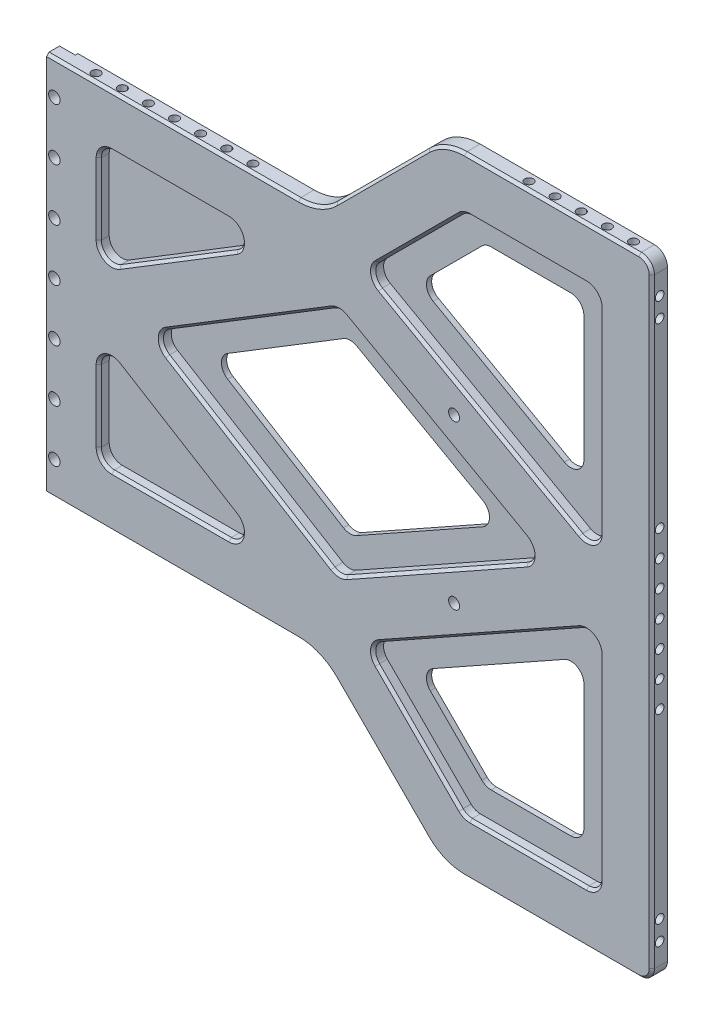
from build123d import *

# Parameters (mm, degrees)
EXTRUDE_1_DEPTH             = 1
EXTRUDE_2_DEPTH             = 5
FILLET_1_R                  = 20
CUT_EXTRUDE_1_DEPTH         = 4
FILLET_2_R                  = 5
CUT_EXTRUDE_2_DEPTH         = 5
FILLET_3_R                  = 5
FILLET_4_R                  = 5
CHAMFER_1_SIZE              = 1
CHAMFER_2_SIZE              = 1
CUT_EXTRUDE_3_DEPTH         = 266.872881163
CUT_EXTRUDE_3_DEPTH_BACK    = 266.872881163
SKETCH_5_R                  = 2.2
HOLE_WIZARD_M4_1_AT_2_COUNT = 2
HOLE_WIZARD_M4_1_AT_2_PITCH = 10
HOLE_WIZARD_M4_1_AT_3_COUNT = 2
HOLE_WIZARD_M4_1_AT_3_PITCH = 20
HOLE_WIZARD_M4_1_AT_4_COUNT = 2
HOLE_WIZARD_M4_1_AT_4_PITCH = 30
HOLE_WIZARD_M4_1_AT_5_COUNT = 2
HOLE_WIZARD_M4_1_AT_5_PITCH = 40
HOLE_WIZARD_M4_1_AT_6_COUNT = 2
HOLE_WIZARD_M4_1_AT_6_PITCH = 50
HOLE_WIZARD_M4_1_AT_7_COUNT = 2
HOLE_WIZARD_M4_1_AT_7_PITCH = 60
HOLE_WIZARD_M4_2_AT_2_COUNT = 2
HOLE_WIZARD_M4_2_AT_2_PITCH = 10
HOLE_WIZARD_M4_2_AT_3_COUNT = 2
HOLE_WIZARD_M4_2_AT_3_PITCH = 20
HOLE_WIZARD_M4_2_AT_4_COUNT = 2
HOLE_WIZARD_M4_2_AT_4_PITCH = 30
HOLE_WIZARD_M4_2_AT_5_COUNT = 2
HOLE_WIZARD_M4_2_AT_5_PITCH = 40
HOLE_WIZARD_M4_3_AT_2_COUNT = 2
HOLE_WIZARD_M4_3_AT_2_PITCH = 7.5
HOLE_WIZARD_M5_1_D          = 4.2
HOLE_WIZARD_M5_1_DEPTH      = 12.4
HOLE_WIZARD_M5_1_TIP        = 1.2618073
HOLE_WIZARD_M4_4_D          = 3.3
HOLE_WIZARD_M4_4_DEPTH      = 10.1
HOLE_WIZARD_M4_4_TIP        = 0.991420021


with BuildPart() as part:
    # 草图1 → 凸台-拉伸1 (new body)
    with BuildSketch(Plane.XY):
        Polygon((11.5, 73), (110.175860782, 73), (157.175860782, 120), (237.175860782, 120), (237.175860782, -120), (157.175860782, -120), (110.175860782, -73), (11.5, -73), align=None)
    extrude(amount=-EXTRUDE_1_DEPTH)

    # 草图2 → 凸台-拉伸2 (add)
    with BuildSketch(Plane.XY):
        Polygon((11.5, 73), (5.5, 73), (5.5, -73), (11.5, -73), (110.175860782, -73), (157.175860782, -120), (237.175860782, -120), (237.175860782, 120), (157.175860782, 120), (110.175860782, 73), align=None)
    extrude(amount=EXTRUDE_2_DEPTH)

    # 圆角1
    fillet_1_edges = [part.edges().sort_by_distance(p)[0] for p in [
        (110.175860782, 73, 2),
        (157.175860782, 120, 2),
        (157.175860782, -120, 2),
        (110.175860782, -73, 2),
    ]]
    fillet(fillet_1_edges, radius=FILLET_1_R)

    # 草图3 → 切除-拉伸1 (cut)
    with BuildSketch(Plane.XY.offset(5)):
        Polygon((196.725411073, 0), (117.41720526, -44.458394956), (44.675653042, 0), (117.41720526, 44.458394956), align=None)
        with BuildLine():
            Line((127.111323554, 61.952213992), (217.175860782, 11.464061769))
            Line((217.175860782, 11.464061769), (217.175860782, 100))
            Line((217.175860782, 100), (165.46013203, 100))
            Line((165.46013203, 100), (130.175860782, 64.715728753))
            ThreePointArc((130.175860782, 64.715728753), (128.679252709, 63.294426421), (127.111323554, 61.952213992))
        make_face()
        with BuildLine():
            Line((217.175860782, -100), (217.175860782, -11.464061769))
            Line((217.175860782, -11.464061769), (127.111323554, -61.952213992))
            ThreePointArc((127.111323554, -61.952213992), (128.679252709, -63.294426421), (130.175860782, -64.715728752))
            Line((130.175860782, -64.715728752), (165.46013203, -100))
            Line((165.46013203, -100), (217.175860782, -100))
        make_face()
        Polygon((25.5, -53), (93.041428657, -53), (25.5, -11.719831794), align=None)
        Polygon((25.5, 11.719831794), (93.041428657, 53), (25.5, 53), align=None)
    extrude(amount=-CUT_EXTRUDE_1_DEPTH, mode=Mode.SUBTRACT)

    # 圆角2
    fillet_2_edges = [part.edges().sort_by_distance(p)[0] for p in [
        (165.46013203, -100, 3),
        (217.175860782, -100, 3),
        (217.175860782, -11.464061769, 3),
        (127.111323554, -61.952213992, 3),
        (217.175860782, 11.464061769, 3),
        (165.46013203, 100, 3),
        (127.111323554, 61.952213992, 3),
        (117.41720526, 44.458394956, 3),
        (44.675653042, 0, 3),
        (117.41720526, -44.458394956, 3),
        (196.725411073, 0, 3),
        (25.5, -53, 3),
        (93.041428657, -53, 3),
        (25.5, -11.719831794, 3),
        (25.5, 53, 3),
        (25.5, 11.719831794, 3),
        (93.041428657, 53, 3),
        (217.175860782, 100, 3),
    ]]
    fillet(fillet_2_edges, radius=FILLET_2_R)

    # 草图4 → 切除-拉伸2 (cut)
    with BuildSketch(Plane.XY.offset(1)):
        Polygon((176.274961364, 0), (117.635483691, 32.871971212), (63.851306083, 0), (117.635483691, -32.871971212), align=None)
        Polygon((143.712370298, 64.110102645), (207.175860782, 28.533898438), (207.175860782, 90), (169.602267653, 90), align=None)
        Polygon((143.712370298, -64.110102644), (169.602267653, -90), (207.175860782, -90), (207.175860782, -28.533898438), align=None)
    extrude(amount=-CUT_EXTRUDE_2_DEPTH, mode=Mode.SUBTRACT)

    # 圆角3
    fillet_3_edges = [part.edges().sort_by_distance(p)[0] for p in [
        (143.712370298, -64.110102644, 0),
        (207.175860782, -28.533898438, 0),
        (207.175860782, -90, 0),
        (169.602267653, -90, 0),
        (143.712370298, 64.110102645, 0),
        (169.602267653, 90, 0),
        (207.175860782, 90, 0),
        (207.175860782, 28.533898438, 0),
        (176.274961364, 0, 0),
        (117.635483691, -32.871971212, 0),
        (63.851306083, 0, 0),
        (117.635483691, 32.871971212, 0),
    ]]
    fillet(fillet_3_edges, radius=FILLET_3_R)

    # 圆角4
    fillet_4_edges = [part.edges().sort_by_distance(p)[0] for p in [
        (237.175860782, 120, 2),
        (237.175860782, -120, 2),
    ]]
    fillet(fillet_4_edges, radius=FILLET_4_R)

    # 倒角1
    chamfer_1_edges = [part.edges().sort_by_distance(p)[0] for p in [
        (189.853530312, -100, 5),
        (147.984212406, -82.524080377, 5),
        (217.175860782, -57.499490052, 5),
        (171.397142773, -37.126580608, 5),
        (217.175860782, 57.499490052, 5),
        (171.397142773, 37.126580608, 5),
        (147.984212406, 82.524080377, 5),
        (189.853530312, 100, 5),
        (83.287438892, 23.598864376, 5),
        (154.458199356, 23.694047456, 5),
        (83.287438892, -23.598864376, 5),
        (154.458199356, -23.694047456, 5),
        (52.886372686, -53, 5),
        (25.5, -34.317831169, 5),
        (55.493845813, -30.051558335, 5),
        (25.5, 34.317831169, 5),
        (52.886372686, 53, 5),
        (55.493845813, 30.051558335, 5),
        (165.61778268, -99.619397663, 5),
        (215.711394688, -98.535533906, 5),
        (214.703243811, -15.684778552, 5),
        (130.555302658, -62.293068947, 5),
        (214.703243811, 15.684778552, 5),
        (165.61778268, 99.619397663, 5),
        (130.555302658, 62.293068948, 5),
        (117.432165413, 43.664296036, 5),
        (49.263479563, 0, 5),
        (117.432165413, -43.664296036, 5),
        (191.500186218, 0, 5),
        (26.964466094, -51.535533906, 5),
        (80.085819451, -49.354369933, 5),
        (28.054326845, -16.274620854, 5),
        (26.964466094, 51.535533906, 5),
        (28.054326845, 16.274620854, 5),
        (80.085819451, 49.354369933, 5),
        (215.711394688, 98.535533906, 5),
    ]]
    chamfer(chamfer_1_edges, length=CHAMFER_1_SIZE)

    # 倒角2
    chamfer_2_edges = [part.edges().sort_by_distance(p)[0] for p in [
        (53.695794767, -73, 5),
        (237.175860782, 0, 5),
        (198.817996406, 120, 5),
        (235.711394688, -118.535533906, 5),
        (235.711394688, 118.535533906, 5),
        (53.695794768, 73, 5),
        (133.675860782, -96.5, 5),
        (198.817996406, -120, 5),
        (133.675860782, 96.5, 5),
        (157.806463382, -118.47759065, 5),
        (157.806463382, 118.47759065, 5),
        (109.545258182, -74.52240935, 5),
        (109.545258182, 74.52240935, 5),
    ]]
    chamfer(chamfer_2_edges, length=CHAMFER_2_SIZE)

    # 草图5 → 切除-拉伸3 (cut, two sides: drawn at the far end of the back side and taken through both)
    with BuildSketch(Plane.XY.offset(5).offset(-CUT_EXTRUDE_3_DEPTH_BACK)):
        with Locations((8.5, 60)):
            Circle(SKETCH_5_R)
        with Locations((8.5, 40)):
            Circle(SKETCH_5_R)
        with Locations((8.5, 20)):
            Circle(SKETCH_5_R)
        with Locations((8.5, 0)):
            Circle(SKETCH_5_R)
        with Locations((8.5, -20)):
            Circle(SKETCH_5_R)
        with Locations((8.5, -40)):
            Circle(SKETCH_5_R)
        with Locations((8.5, -60)):
            Circle(SKETCH_5_R)
    extrude(amount=CUT_EXTRUDE_3_DEPTH + CUT_EXTRUDE_3_DEPTH_BACK, mode=Mode.SUBTRACT)

    # 草图8 → M4 螺纹孔1 (revolve, cut)
    with BuildSketch(Plane(origin=(81.5, -73, 2), x_dir=(0, 0, -1), z_dir=(1, 0, 0))):
        Polygon((0, 0), (0, 11.091420021), (1.65, 10.1), (1.65, 0), align=None)
    hole_wizard_m4_1 = revolve(axis=Axis((81.5, -79.35, 2), (0, 1, 0)), mode=Mode.SUBTRACT)

    # M4 螺纹孔1 at 2: M4 螺纹孔1 ×2
    with Locations(*[(-i * HOLE_WIZARD_M4_1_AT_2_PITCH, 0, 0) for i in range(1, HOLE_WIZARD_M4_1_AT_2_COUNT)]):
        add(hole_wizard_m4_1, mode=Mode.SUBTRACT)

    # M4 螺纹孔1 at 3: M4 螺纹孔1 ×2
    with Locations(*[(-i * HOLE_WIZARD_M4_1_AT_3_PITCH, 0, 0) for i in range(1, HOLE_WIZARD_M4_1_AT_3_COUNT)]):
        add(hole_wizard_m4_1, mode=Mode.SUBTRACT)

    # M4 螺纹孔1 at 4: M4 螺纹孔1 ×2
    with Locations(*[(-i * HOLE_WIZARD_M4_1_AT_4_PITCH, 0, 0) for i in range(1, HOLE_WIZARD_M4_1_AT_4_COUNT)]):
        add(hole_wizard_m4_1, mode=Mode.SUBTRACT)

    # M4 螺纹孔1 at 5: M4 螺纹孔1 ×2
    with Locations(*[(-i * HOLE_WIZARD_M4_1_AT_5_PITCH, 0, 0) for i in range(1, HOLE_WIZARD_M4_1_AT_5_COUNT)]):
        add(hole_wizard_m4_1, mode=Mode.SUBTRACT)

    # M4 螺纹孔1 at 6: M4 螺纹孔1 ×2
    with Locations(*[(-i * HOLE_WIZARD_M4_1_AT_6_PITCH, 0, 0) for i in range(1, HOLE_WIZARD_M4_1_AT_6_COUNT)]):
        add(hole_wizard_m4_1, mode=Mode.SUBTRACT)

    # M4 螺纹孔1 at 7: M4 螺纹孔1 ×2
    with Locations(*[(-i * HOLE_WIZARD_M4_1_AT_7_PITCH, 0, 0) for i in range(1, HOLE_WIZARD_M4_1_AT_7_COUNT)]):
        add(hole_wizard_m4_1, mode=Mode.SUBTRACT)

    # 镜向1: M4 螺纹孔1 across plane
    add(hole_wizard_m4_1.mirror(Plane.ZX), mode=Mode.SUBTRACT)

    # 镜向1 copy 1 sketch → 镜向1 copy 1 (revolve, cut)
    with BuildSketch(Plane(origin=(71.5, 73, 2), x_dir=(0, 0, -1), z_dir=(1, 0, 0))):
        Polygon((0, 0), (0, -11.091420021), (1.65, -10.1), (1.65, 0), align=None)
    revolve(axis=Axis((71.5, 79.35, 2), (0, 1, 0)), mode=Mode.SUBTRACT)

    # 镜向1 copy 2 sketch → 镜向1 copy 2 (revolve, cut)
    with BuildSketch(Plane(origin=(61.5, 73, 2), x_dir=(0, 0, -1), z_dir=(1, 0, 0))):
        Polygon((0, 0), (0, -11.091420021), (1.65, -10.1), (1.65, 0), align=None)
    revolve(axis=Axis((61.5, 79.35, 2), (0, 1, 0)), mode=Mode.SUBTRACT)

    # 镜向1 copy 3 sketch → 镜向1 copy 3 (revolve, cut)
    with BuildSketch(Plane(origin=(51.5, 73, 2), x_dir=(0, 0, -1), z_dir=(1, 0, 0))):
        Polygon((0, 0), (0, -11.091420021), (1.65, -10.1), (1.65, 0), align=None)
    revolve(axis=Axis((51.5, 79.35, 2), (0, 1, 0)), mode=Mode.SUBTRACT)

    # 镜向1 copy 4 sketch → 镜向1 copy 4 (revolve, cut)
    with BuildSketch(Plane(origin=(41.5, 73, 2), x_dir=(0, 0, -1), z_dir=(1, 0, 0))):
        Polygon((0, 0), (0, -11.091420021), (1.65, -10.1), (1.65, 0), align=None)
    revolve(axis=Axis((41.5, 79.35, 2), (0, 1, 0)), mode=Mode.SUBTRACT)

    # 镜向1 copy 5 sketch → 镜向1 copy 5 (revolve, cut)
    with BuildSketch(Plane(origin=(31.5, 73, 2), x_dir=(0, 0, -1), z_dir=(1, 0, 0))):
        Polygon((0, 0), (0, -11.091420021), (1.65, -10.1), (1.65, 0), align=None)
    revolve(axis=Axis((31.5, 79.35, 2), (0, 1, 0)), mode=Mode.SUBTRACT)

    # 镜向1 copy 6 sketch → 镜向1 copy 6 (revolve, cut)
    with BuildSketch(Plane(origin=(21.5, 73, 2), x_dir=(0, 0, -1), z_dir=(1, 0, 0))):
        Polygon((0, 0), (0, -11.091420021), (1.65, -10.1), (1.65, 0), align=None)
    revolve(axis=Axis((21.5, 79.35, 2), (0, 1, 0)), mode=Mode.SUBTRACT)

    # 草图11 → M4 螺纹孔2 (revolve, cut)
    with BuildSketch(Plane(origin=(227.175860782, -120, 2), x_dir=(0, 0, -1), z_dir=(1, 0, 0))):
        Polygon((0, 0), (0, 11.091420021), (1.65, 10.1), (1.65, 0), align=None)
    hole_wizard_m4_2 = revolve(axis=Axis((227.175860782, -126.35, 2), (0, 1, 0)), mode=Mode.SUBTRACT)

    # M4 螺纹孔2 at 2: M4 螺纹孔2 ×2
    with Locations(*[(-i * HOLE_WIZARD_M4_2_AT_2_PITCH, 0, 0) for i in range(1, HOLE_WIZARD_M4_2_AT_2_COUNT)]):
        add(hole_wizard_m4_2, mode=Mode.SUBTRACT)

    # M4 螺纹孔2 at 3: M4 螺纹孔2 ×2
    with Locations(*[(-i * HOLE_WIZARD_M4_2_AT_3_PITCH, 0, 0) for i in range(1, HOLE_WIZARD_M4_2_AT_3_COUNT)]):
        add(hole_wizard_m4_2, mode=Mode.SUBTRACT)

    # M4 螺纹孔2 at 4: M4 螺纹孔2 ×2
    with Locations(*[(-i * HOLE_WIZARD_M4_2_AT_4_PITCH, 0, 0) for i in range(1, HOLE_WIZARD_M4_2_AT_4_COUNT)]):
        add(hole_wizard_m4_2, mode=Mode.SUBTRACT)

    # M4 螺纹孔2 at 5: M4 螺纹孔2 ×2
    with Locations(*[(-i * HOLE_WIZARD_M4_2_AT_5_PITCH, 0, 0) for i in range(1, HOLE_WIZARD_M4_2_AT_5_COUNT)]):
        add(hole_wizard_m4_2, mode=Mode.SUBTRACT)

    # 镜向2: M4 螺纹孔2 across plane
    add(hole_wizard_m4_2.mirror(Plane.ZX), mode=Mode.SUBTRACT)

    # 镜向2 copy 1 sketch → 镜向2 copy 1 (revolve, cut)
    with BuildSketch(Plane(origin=(217.175860782, 120, 2), x_dir=(0, 0, -1), z_dir=(1, 0, 0))):
        Polygon((0, 0), (0, -11.091420021), (1.65, -10.1), (1.65, 0), align=None)
    revolve(axis=Axis((217.175860782, 126.35, 2), (0, 1, 0)), mode=Mode.SUBTRACT)

    # 镜向2 copy 2 sketch → 镜向2 copy 2 (revolve, cut)
    with BuildSketch(Plane(origin=(207.175860782, 120, 2), x_dir=(0, 0, -1), z_dir=(1, 0, 0))):
        Polygon((0, 0), (0, -11.091420021), (1.65, -10.1), (1.65, 0), align=None)
    revolve(axis=Axis((207.175860782, 126.35, 2), (0, 1, 0)), mode=Mode.SUBTRACT)

    # 镜向2 copy 3 sketch → 镜向2 copy 3 (revolve, cut)
    with BuildSketch(Plane(origin=(197.175860782, 120, 2), x_dir=(0, 0, -1), z_dir=(1, 0, 0))):
        Polygon((0, 0), (0, -11.091420021), (1.65, -10.1), (1.65, 0), align=None)
    revolve(axis=Axis((197.175860782, 126.35, 2), (0, 1, 0)), mode=Mode.SUBTRACT)

    # 镜向2 copy 4 sketch → 镜向2 copy 4 (revolve, cut)
    with BuildSketch(Plane(origin=(187.175860782, 120, 2), x_dir=(0, 0, -1), z_dir=(1, 0, 0))):
        Polygon((0, 0), (0, -11.091420021), (1.65, -10.1), (1.65, 0), align=None)
    revolve(axis=Axis((187.175860782, 126.35, 2), (0, 1, 0)), mode=Mode.SUBTRACT)

    # 草图14 → M4 螺纹孔3 (revolve, cut)
    with BuildSketch(Plane(origin=(237.175860782, -99.5, 2), x_dir=(0, 0, -1), z_dir=(0, 1, 0))):
        Polygon((0, 0), (0, 11.091420021), (1.65, 10.1), (1.65, 0), align=None)
    hole_wizard_m4_3 = revolve(axis=Axis((243.525860782, -99.5, 2), (-1, 0, 0)), mode=Mode.SUBTRACT)

    # M4 螺纹孔3 at 2: M4 螺纹孔3 ×2
    with Locations(*[(0, -i * HOLE_WIZARD_M4_3_AT_2_PITCH, 0) for i in range(1, HOLE_WIZARD_M4_3_AT_2_COUNT)]):
        add(hole_wizard_m4_3, mode=Mode.SUBTRACT)

    # 镜向3: M4 螺纹孔3 across plane
    add(hole_wizard_m4_3.mirror(Plane.ZX), mode=Mode.SUBTRACT)

    # 镜向3 copy 1 sketch → 镜向3 copy 1 (revolve, cut)
    with BuildSketch(Plane(origin=(237.175860782, 107, 2), x_dir=(0, 0, -1), z_dir=(0, -1, 0))):
        Polygon((0, 0), (0, -11.091420021), (1.65, -10.1), (1.65, 0), align=None)
    revolve(axis=Axis((243.525860782, 107, 2), (1, 0, 0)), mode=Mode.SUBTRACT)

    # M5 螺纹孔1
    with Locations(Plane.XY.offset(5)):
        with Locations((161.5, 31.210634294), (161.5, -31.210634294)):
            Hole(HOLE_WIZARD_M5_1_D / 2, depth=HOLE_WIZARD_M5_1_DEPTH)
            with Locations((0, 0, -(HOLE_WIZARD_M5_1_DEPTH + HOLE_WIZARD_M5_1_TIP / 2))):  # 118° drill point
                Cone(0, HOLE_WIZARD_M5_1_D / 2, HOLE_WIZARD_M5_1_TIP, mode=Mode.SUBTRACT)

    # M4 螺纹孔4
    with Locations(Plane(origin=(237.175860782, 0, 0), x_dir=(0, 0, -1), z_dir=(1, 0, 0))):
        with Locations((-2, 30), (-2, 20), (-2, 10), (-2, 0), (-2, -10), (-2, -20), (-2, -30)):
            Hole(HOLE_WIZARD_M4_4_D / 2, depth=HOLE_WIZARD_M4_4_DEPTH)
            with Locations((0, 0, -(HOLE_WIZARD_M4_4_DEPTH + HOLE_WIZARD_M4_4_TIP / 2))):  # 118° drill point
                Cone(0, HOLE_WIZARD_M4_4_D / 2, HOLE_WIZARD_M4_4_TIP, mode=Mode.SUBTRACT)


solid = part.part
